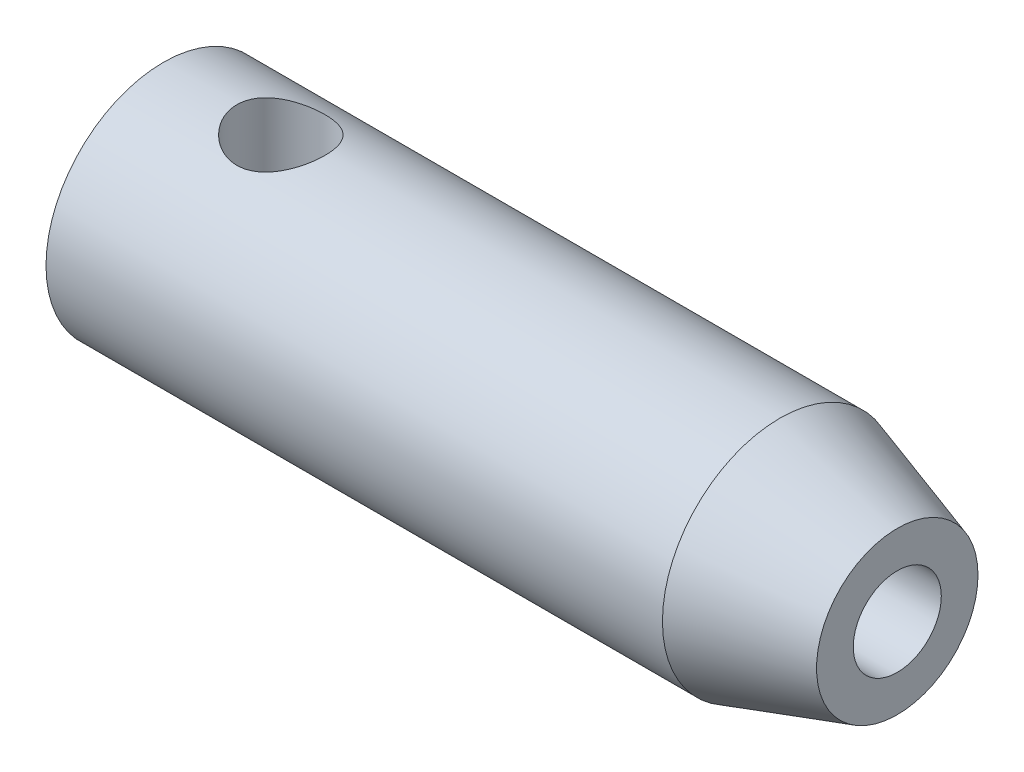
from build123d import *

# Parameters (mm, degrees)
SKETCH1_W      = 21
SKETCH1_H      = 4
SKETCH2_R      = 1.5
EXTRUDE4_DEPTH = 26.632011236
SKETCH3_R      = 1.5
EXTRUDE5_DEPTH = 10


with BuildPart() as part:
    # Sketch1 → Revolve1 (revolve)
    with BuildSketch(Plane.XY, mode=Mode.PRIVATE) as revolve1_sk:
        with Locations((10.5, 2)):
            Rectangle(SKETCH1_W, SKETCH1_H)
        Polygon((21, 4), (21, 0), (25, 0), (25, 2.75), align=None)
    revolve(revolve1_sk.sketch.rotate(Axis((25, 0, 0), (-1, 0, 0)), 90), axis=Axis((25, 0, 0), (-1, 0, 0)))

    # Sketch2 → Extrude4 (cut, through all)
    with BuildSketch(Plane(origin=(0, 0, 0), x_dir=(0, 0, -1), z_dir=(1, 0, 0))):
        Circle(SKETCH2_R)
    extrude(amount=EXTRUDE4_DEPTH, mode=Mode.SUBTRACT)

    # Sketch3 → Extrude5 (cut)
    with BuildSketch(Plane(origin=(0, 0, 0), x_dir=(1, 0, 0), z_dir=(0, 1, 0))):
        with Locations(Location((4, 0, 0), (0, 0, 90))):
            Circle(SKETCH3_R)
    extrude(amount=EXTRUDE5_DEPTH, mode=Mode.SUBTRACT)


solid = part.part
